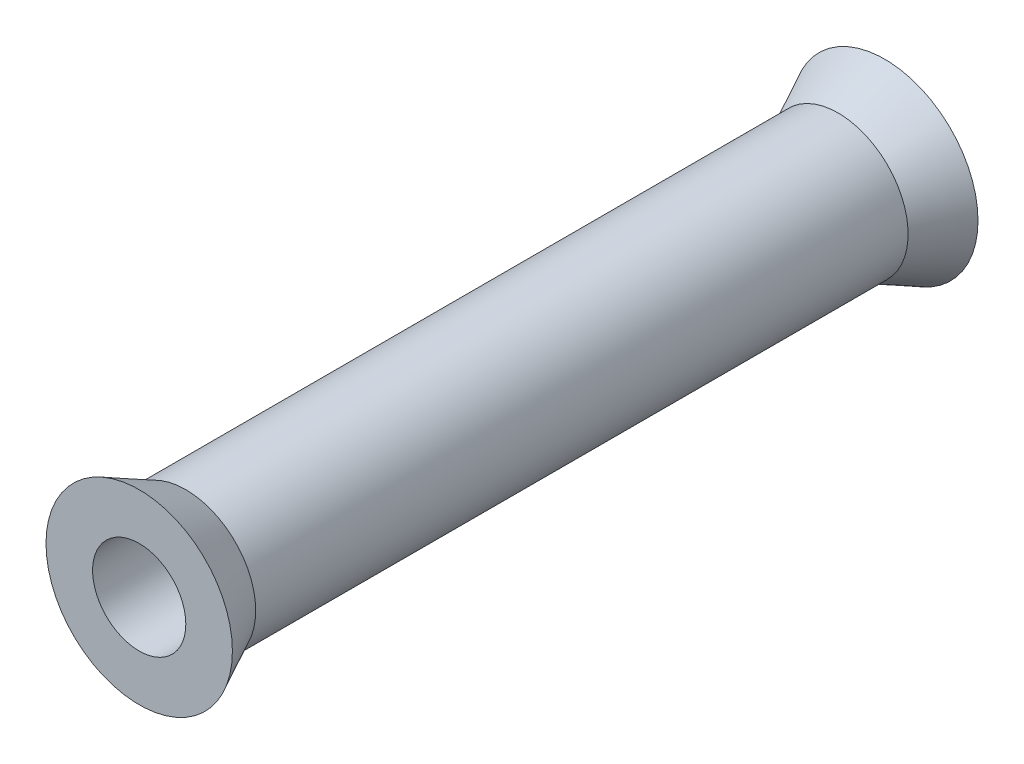
from build123d import *

# Parameters (mm, degrees)
SKETCH1_R           = 6.35
SKETCH1_R_2         = 3.175
BOSS_EXTRUDE1_DEPTH = 25.4


with BuildPart() as part:
    # Sketch1 → Boss-Extrude1 (new, symmetric)
    with BuildSketch(Plane.XY):
        Circle(SKETCH1_R)
        Circle(SKETCH1_R_2, mode=Mode.SUBTRACT)
    extrude(amount=BOSS_EXTRUDE1_DEPTH, both=True)

    # Sketch2 → Cut-Revolve2 (revolve, cut)
    with BuildSketch(Plane(origin=(0, 0, 0), x_dir=(0, 0, -1), z_dir=(1, 0, 0)), mode=Mode.PRIVATE) as cut_revolve2_sk:
        Polygon((-28.575, 11.1125), (-28.575, 7.9375), (-22.225, 4.7625), (22.225, 4.7625), (28.575, 7.9375), (28.575, 11.1125), align=None)
    revolve(cut_revolve2_sk.sketch.rotate(Axis((0, 0, 0), (0, 0, 1)), 90), axis=Axis((0, 0, 0), (0, 0, 1)), mode=Mode.SUBTRACT)


solid = part.part
